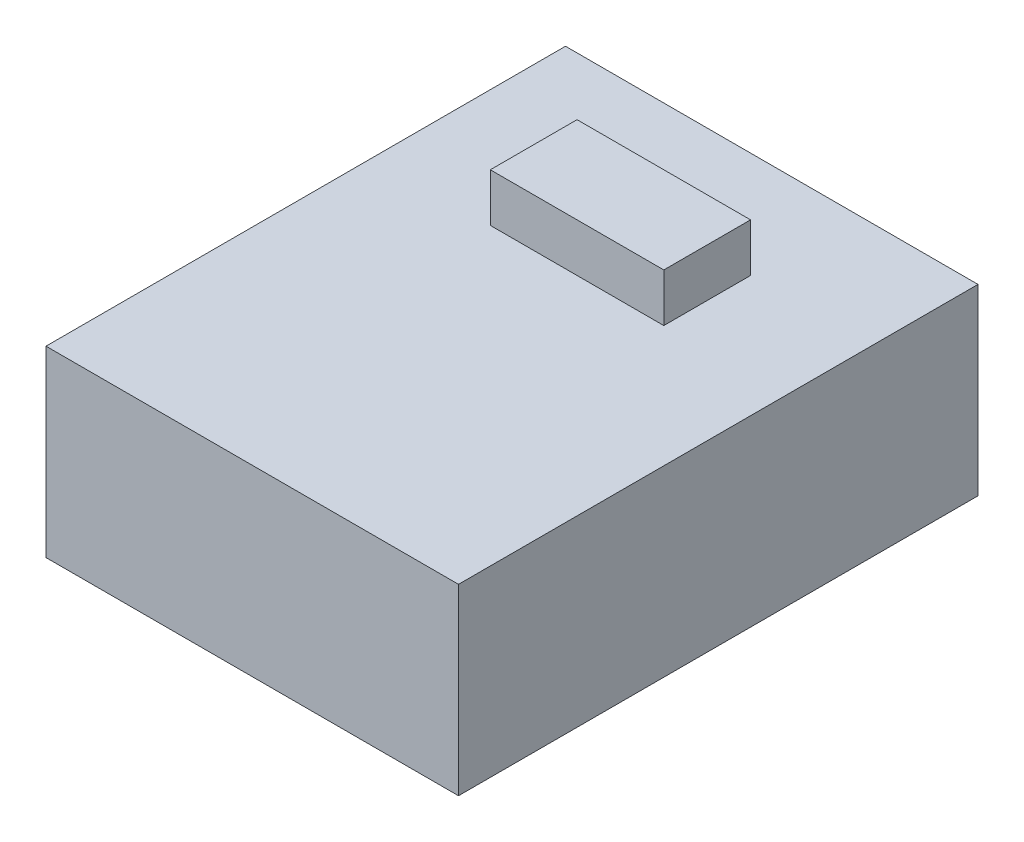
from build123d import *

# Parameters (mm, degrees)
ESQUISSE1_W        = 42.8
ESQUISSE1_H        = 53.9
BOSS_EXTRU_1_DEPTH = 19
ESQUISSE2_W        = 18
ESQUISSE2_H        = 9
BOSS_EXTRU_2_DEPTH = 5


with BuildPart() as part:
    # Esquisse1 → Boss.-Extru.1 (new body)
    with BuildSketch(Plane(origin=(0, 0, 0), x_dir=(1, 0, 0), z_dir=(0, 1, 0))):
        with Locations((21.4, 26.95)):
            Rectangle(ESQUISSE1_W, ESQUISSE1_H)
    extrude(amount=BOSS_EXTRU_1_DEPTH)

    # Esquisse2 → Boss.-Extru.2 (add)
    with BuildSketch(Plane(origin=(0, 19, 0), x_dir=(1, 0, 0), z_dir=(0, 1, 0))):
        with Locations((21.2, 38.4)):
            Rectangle(ESQUISSE2_W, ESQUISSE2_H)
    extrude(amount=BOSS_EXTRU_2_DEPTH)


solid = part.part
